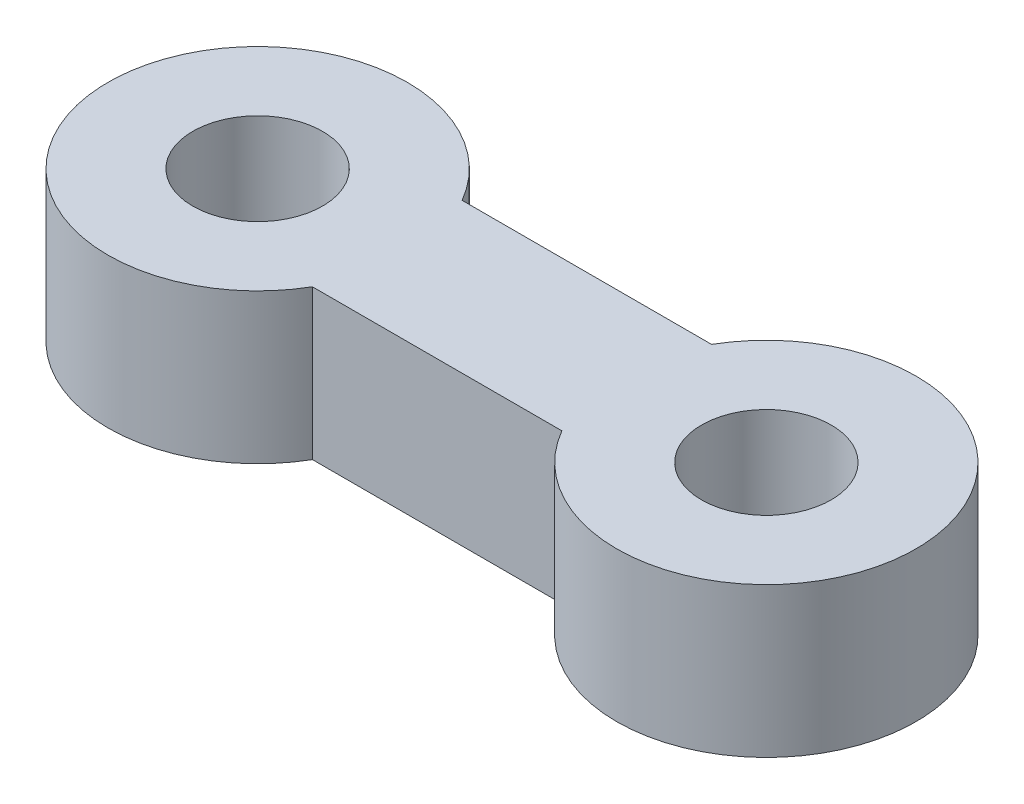
from build123d import *

# Parameters (mm, degrees)
SKETCH1_R           = 1.3
BOSS_EXTRUDE1_DEPTH = 3


with BuildPart() as part:
    # Sketch1 → Boss-Extrude1 (new body)
    with BuildSketch(Plane(origin=(0, 0, 0), x_dir=(1, 0, 0), z_dir=(0, 1, 0))):
        with BuildLine():
            Line((2.598076211, 1.5), (7.598076211, 1.5))
            ThreePointArc((7.598076211, 1.5), (13.196152423, 0), (7.598076211, -1.5))
            Line((7.598076211, -1.5), (2.598076211, -1.5))
            ThreePointArc((2.598076211, -1.5), (-3, 0), (2.598076211, 1.5))
        make_face()
        with Locations(Location((0, 0, 0), (0, 0, 270))):
            Circle(SKETCH1_R, mode=Mode.SUBTRACT)
        with Locations(Location((10.196152423, 0, 0), (0, 0, 270))):
            Circle(SKETCH1_R, mode=Mode.SUBTRACT)
    extrude(amount=BOSS_EXTRUDE1_DEPTH)


solid = part.part
